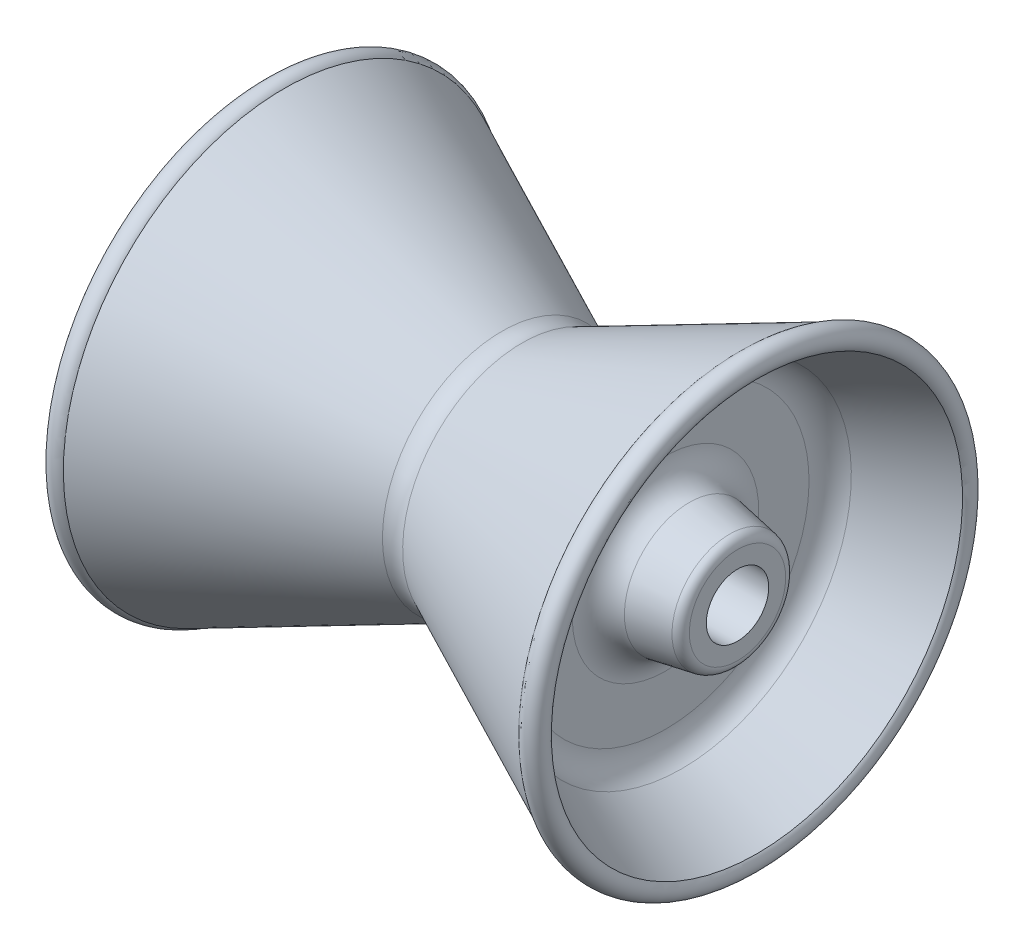
from build123d import *


with BuildPart() as part:
    # Sketch1 → Revolve1 (revolve)
    with BuildSketch(Plane.XY, mode=Mode.PRIVATE) as revolve1_sk:
        with BuildLine():
            Line((-234.789217647, 32.5), (-234.789217647, 50.155527323))
            ThreePointArc((-234.789217647, 50.155527323), (-232.456291164, 56.575494899), (-226.546020911, 60))
            Line((-226.546020911, 60), (-184.518807854, 67.5))
            ThreePointArc((-184.518807854, 67.5), (-166.787997094, 77.773515303), (-159.789217647, 97.033418031))
            Line((-159.789217647, 97.033418031), (-159.789217647, 149.439238081))
            ThreePointArc((-159.789217647, 149.439238081), (-164.395791257, 165.413401477), (-176.800810726, 176.481820902))
            Line((-176.800810726, 176.481820902), (-255, 214.040470454))
            ThreePointArc((-255, 214.040470454), (-254.107992287, 231.082137047), (-237.077341757, 230))
            Line((-237.077341757, 230), (-10.522337646, 124.35566659))
            ThreePointArc((-10.522337646, 124.35566659), (0, 122.033418031), (10.522337646, 124.35566659))
            Line((10.522337646, 124.35566659), (237.077341757, 230))
            ThreePointArc((237.077341757, 230), (254.107992287, 231.082137047), (255, 214.040470454))
            Line((255, 214.040470454), (176.800810726, 176.481820902))
            ThreePointArc((176.800810726, 176.481820902), (164.395791257, 165.413401477), (159.789217647, 149.439238081))
            Line((159.789217647, 149.439238081), (159.789217647, 97.033418031))
            ThreePointArc((159.789217647, 97.033418031), (166.787997094, 77.773515303), (184.518807854, 67.5))
            Line((184.518807854, 67.5), (226.546020911, 60))
            ThreePointArc((226.546020911, 60), (232.456291164, 56.575494899), (234.789217647, 50.155527323))
            Line((234.789217647, 50.155527323), (234.789217647, 32.5))
            Line((234.789217647, 32.5), (130, 32.5))
            Line((130, 32.5), (130, 106.313960308))
            ThreePointArc((130, 106.313960308), (115.974163396, 131.707386698), (87.011593079, 133.35654313))
            Line((87.011593079, 133.35654313), (21.647344868, 101.962446662))
            ThreePointArc((21.647344868, 101.962446662), (0, 97.033418031), (-21.647344868, 101.962446662))
            Line((-21.647344868, 101.962446662), (-87.011593079, 133.35654313))
            ThreePointArc((-87.011593079, 133.35654313), (-115.974163396, 131.707386698), (-130, 106.313960308))
            Line((-130, 106.313960308), (-130, 32.5))
            Line((-130, 32.5), (-234.789217647, 32.5))
        make_face()
    revolve(revolve1_sk.sketch.rotate(Axis((-235, 0, 0), (1, 0, 0)), 180), axis=Axis((-235, 0, 0), (1, 0, 0)))


solid = part.part
